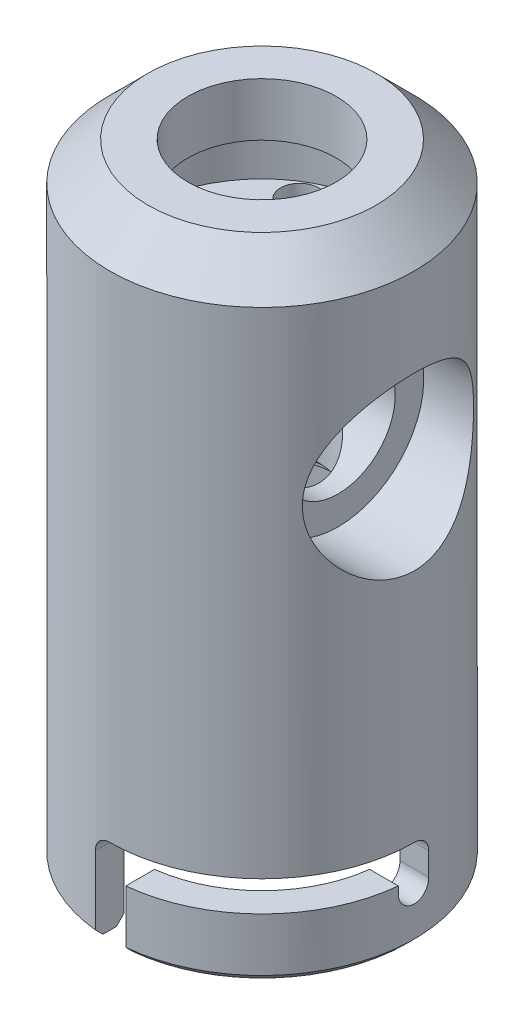
from build123d import *

# Parameters (mm, degrees)
BOSS_EXTRUDE1_DEPTH      = 29
BOSS_EXTRUDE1_DEPTH_BACK = 53
SKETCH2_R                = 20
CHAMFER1_SIZE            = 5
CHAMFER3_SIZE            = 1
CUT_EXTRUDE1_DEPTH       = 61.074953251
CUT_EXTRUDE1_DEPTH_BACK  = 61.074953251
CUT_EXTRUDE2_DEPTH       = 61.074953261
CUT_EXTRUDE2_DEPTH_BACK  = 61.074953261
SKETCH9_W                = 39.403997472
SKETCH9_H                = 4
CUT_EXTRUDE3_DEPTH       = 61.074953261
SKETCH10_W               = 32.489089837
SKETCH10_H               = 4
CUT_EXTRUDE5_DEPTH       = 61.074953261
SKETCH12_R               = 2.5
CUT_EXTRUDE6_DEPTH       = 27


with BuildPart() as part:
    # Sketch2 → Boss-Extrude1 (new, two sides: drawn at the far end of the back side and taken through both)
    with BuildSketch(Plane(origin=(0, 0, 0), x_dir=(1, 0, 0), z_dir=(0, 1, 0)).offset(-BOSS_EXTRUDE1_DEPTH_BACK)):
        with Locations(Location((0, 0, 0), (0, 0, 270))):
            Circle(SKETCH2_R)
    extrude(amount=BOSS_EXTRUDE1_DEPTH + BOSS_EXTRUDE1_DEPTH_BACK)

    # Chamfer1
    chamfer1_edges = [part.edges().sort_by_distance(p)[0] for p in [
        (0, 29, -20),
    ]]
    chamfer(chamfer1_edges, length=CHAMFER1_SIZE)

    # Sketch3 → Cut-Revolve1 (revolve, cut)
    with BuildSketch(Plane.XY, mode=Mode.PRIVATE) as cut_revolve1_sk:
        Polygon((20, 1.146940532), (20, 12.396940532), (10, 12.396940532), (10, 8.646940532), (-11, 8.646940532), (-15, 3.146940532), (-19, 3.146940532), (-19, 6.146940532), (-20, 6.146940532), (-20, 1.146940532), align=None)
    revolve(cut_revolve1_sk.sketch.rotate(Axis((-20, 1.146940532, 0), (1, 0, 0)), 180), axis=Axis((-20, 1.146940532, 0), (1, 0, 0)), mode=Mode.SUBTRACT)

    # Sketch4 → Cut-Revolve2 (revolve, cut)
    with BuildSketch(Plane(origin=(0, 0, 0), x_dir=(0, 0, -1), z_dir=(1, 0, 0))):
        Polygon((0, 13), (0, 29), (-9.75, 29), (-9.75, 22), (-16.25, 22), (-16.25, 13), align=None)
        Polygon((0, -53), (0, 1.146940532), (-7.5, 1.146940532), (-7.5, -12.6), (-9.75, -12.6), (-9.75, -14), (-16.25, -14), (-16.25, -53), align=None)
    revolve(axis=Axis((0, 29, 0), (0, -1, 0)), mode=Mode.SUBTRACT)

    # Chamfer3
    chamfer3_edges = [part.edges().sort_by_distance(p)[0] for p in [
        (0, -12.6, -7.5),
        (0, -12.6, -9.75),
        (0, -53, -16.25),
        (0, -53, -20),
    ]]
    chamfer(chamfer3_edges, length=CHAMFER3_SIZE)

    # Sketch5 → Cut-Extrude1 (cut, two sides: drawn at the far end of the back side and taken through both)
    with BuildSketch(Plane(origin=(0, 0, 0), x_dir=(0, 0, -1), z_dir=(1, 0, 0)).offset(-CUT_EXTRUDE1_DEPTH_BACK)):
        with BuildLine():
            Line((2, -43), (2, -46))
            ThreePointArc((2, -46), (0, -48), (-2, -46))
            Line((-2, -46), (-2, -43))
            ThreePointArc((-2, -43), (0, -41), (2, -43))
        make_face()
    extrude(amount=CUT_EXTRUDE1_DEPTH + CUT_EXTRUDE1_DEPTH_BACK, mode=Mode.SUBTRACT)

    # Sketch6 → Cut-Extrude2 (cut, two sides: drawn at the far end of the back side and taken through both)
    with BuildSketch(Plane.XY.offset(-CUT_EXTRUDE2_DEPTH_BACK)):
        with BuildLine():
            Line((2, -43), (2, -63))
            ThreePointArc((2, -63), (0, -65), (-2, -63))
            Line((-2, -63), (-2, -43))
            ThreePointArc((-2, -43), (0, -41), (2, -43))
        make_face()
    extrude(amount=CUT_EXTRUDE2_DEPTH + CUT_EXTRUDE2_DEPTH_BACK, mode=Mode.SUBTRACT)

    # Sketch9 → Cut-Extrude3 (cut, through all)
    with BuildSketch(Plane.XY):
        with Locations((19.701998736, -43)):
            Rectangle(SKETCH9_W, SKETCH9_H)
    extrude(amount=CUT_EXTRUDE3_DEPTH, mode=Mode.SUBTRACT)

    # Sketch10 → Cut-Extrude5 (cut, through all)
    with BuildSketch(Plane.XY):
        with Locations((-16.244544919, -43)):
            Rectangle(SKETCH10_W, SKETCH10_H)
    extrude(amount=-CUT_EXTRUDE5_DEPTH, mode=Mode.SUBTRACT)

    # Sketch12 → Cut-Extrude6 (cut)
    with BuildSketch(Plane.XZ.offset(14)):
        with Locations(Location((6.75, 11.691342951, 0), (0, 0, 270))):
            Circle(SKETCH12_R)
        with Locations(Location((-6.75, 11.691342951, 0), (0, 0, 270))):
            Circle(SKETCH12_R)
        with Locations(Location((6.75, -11.691342951, 0), (0, 0, 270))):
            Circle(SKETCH12_R)
        with Locations(Location((-6.75, -11.691342951, 0), (0, 0, 270))):
            Circle(SKETCH12_R)
    extrude(amount=-CUT_EXTRUDE6_DEPTH, mode=Mode.SUBTRACT)


solid = part.part
